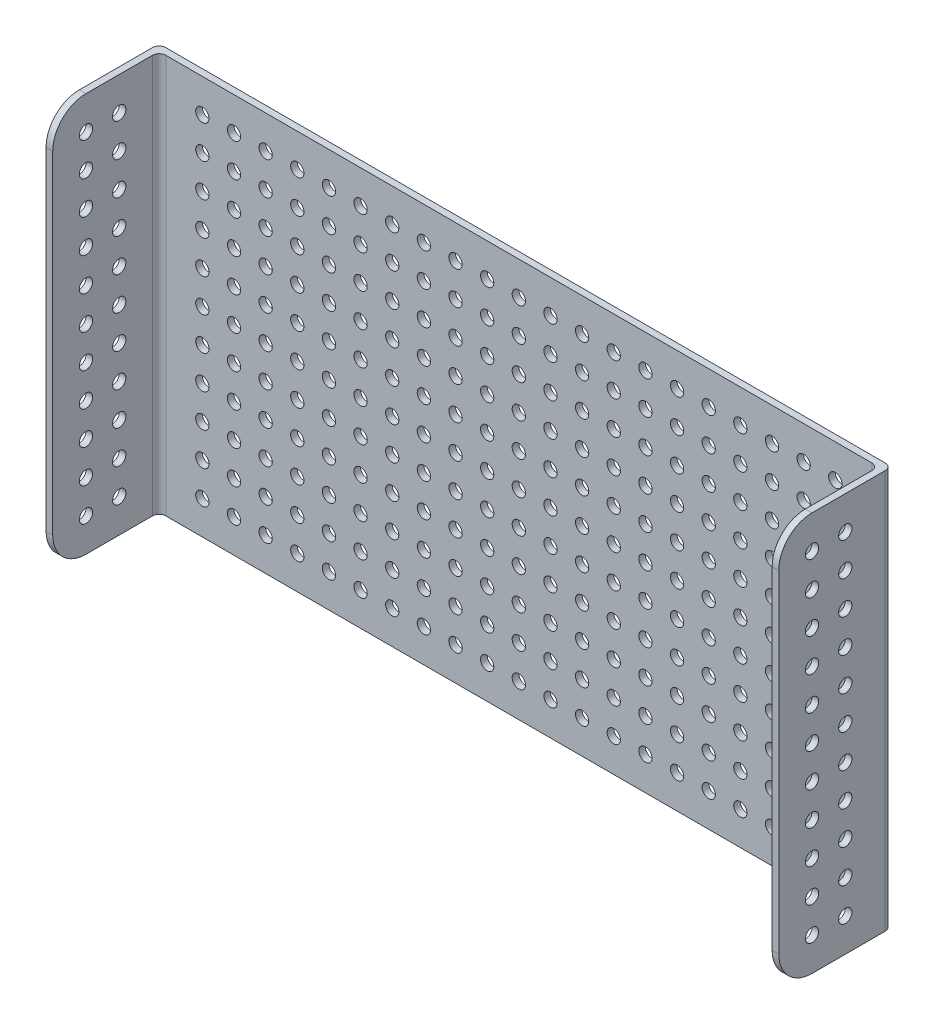
from build123d import *

# Parameters (mm, degrees)
IZIM1_W                     = 220.4
IZIM1_H                     = 120
IZIM1_R                     = 2
Y_KSEKLIK_EKSTR_ZYON1_DEPTH = 2
IZIM3_W                     = 2
IZIM3_H                     = 120
TOP_HOLES_DEPTH             = 32
IZIM4_R                     = 2
KES_EKSTR_ZYON1_DEPTH       = 231.937567321
RADYUS1_R                   = 2
RADYUS2_R                   = 10


with BuildPart() as part:
    # Çizim1 → Yükseklik-Ekstrüzyon1 (new body)
    with BuildSketch(Plane.XY):
        Rectangle(IZIM1_W, IZIM1_H)
        with Locations((95.2, 50)):
            Circle(IZIM1_R, mode=Mode.SUBTRACT)
        with Locations((85.68, 50)):
            Circle(IZIM1_R, mode=Mode.SUBTRACT)
        with Locations((76.16, 50)):
            Circle(IZIM1_R, mode=Mode.SUBTRACT)
        with Locations((66.64, 50)):
            Circle(IZIM1_R, mode=Mode.SUBTRACT)
        with Locations((57.12, 50)):
            Circle(IZIM1_R, mode=Mode.SUBTRACT)
        with Locations((47.6, 50)):
            Circle(IZIM1_R, mode=Mode.SUBTRACT)
        with Locations((38.08, 50)):
            Circle(IZIM1_R, mode=Mode.SUBTRACT)
        with Locations((28.56, 50)):
            Circle(IZIM1_R, mode=Mode.SUBTRACT)
        with Locations((19.04, 50)):
            Circle(IZIM1_R, mode=Mode.SUBTRACT)
        with Locations((9.52, 50)):
            Circle(IZIM1_R, mode=Mode.SUBTRACT)
        with Locations((0, 50)):
            Circle(IZIM1_R, mode=Mode.SUBTRACT)
        with Locations((-9.52, 50)):
            Circle(IZIM1_R, mode=Mode.SUBTRACT)
        with Locations((-19.04, 50)):
            Circle(IZIM1_R, mode=Mode.SUBTRACT)
        with Locations((-28.56, 50)):
            Circle(IZIM1_R, mode=Mode.SUBTRACT)
        with Locations((-38.08, 50)):
            Circle(IZIM1_R, mode=Mode.SUBTRACT)
        with Locations((-47.6, 50)):
            Circle(IZIM1_R, mode=Mode.SUBTRACT)
        with Locations((-57.12, 50)):
            Circle(IZIM1_R, mode=Mode.SUBTRACT)
        with Locations((-66.64, 50)):
            Circle(IZIM1_R, mode=Mode.SUBTRACT)
        with Locations((-76.16, 50)):
            Circle(IZIM1_R, mode=Mode.SUBTRACT)
        with Locations((-85.68, 50)):
            Circle(IZIM1_R, mode=Mode.SUBTRACT)
        with Locations((-95.2, 50)):
            Circle(IZIM1_R, mode=Mode.SUBTRACT)
        with Locations((85.68, 40)):
            Circle(IZIM1_R, mode=Mode.SUBTRACT)
        with Locations((76.16, 40)):
            Circle(IZIM1_R, mode=Mode.SUBTRACT)
        with Locations((66.64, 40)):
            Circle(IZIM1_R, mode=Mode.SUBTRACT)
        with Locations((57.12, 40)):
            Circle(IZIM1_R, mode=Mode.SUBTRACT)
        with Locations((47.6, 40)):
            Circle(IZIM1_R, mode=Mode.SUBTRACT)
        with Locations((38.08, 40)):
            Circle(IZIM1_R, mode=Mode.SUBTRACT)
        with Locations((28.56, 40)):
            Circle(IZIM1_R, mode=Mode.SUBTRACT)
        with Locations((19.04, 40)):
            Circle(IZIM1_R, mode=Mode.SUBTRACT)
        with Locations((9.52, 40)):
            Circle(IZIM1_R, mode=Mode.SUBTRACT)
        with Locations((0, 40)):
            Circle(IZIM1_R, mode=Mode.SUBTRACT)
        with Locations((-9.52, 40)):
            Circle(IZIM1_R, mode=Mode.SUBTRACT)
        with Locations((-19.04, 40)):
            Circle(IZIM1_R, mode=Mode.SUBTRACT)
        with Locations((-28.56, 40)):
            Circle(IZIM1_R, mode=Mode.SUBTRACT)
        with Locations((-38.08, 40)):
            Circle(IZIM1_R, mode=Mode.SUBTRACT)
        with Locations((-47.6, 40)):
            Circle(IZIM1_R, mode=Mode.SUBTRACT)
        with Locations((-57.12, 40)):
            Circle(IZIM1_R, mode=Mode.SUBTRACT)
        with Locations((-66.64, 40)):
            Circle(IZIM1_R, mode=Mode.SUBTRACT)
        with Locations((-76.16, 40)):
            Circle(IZIM1_R, mode=Mode.SUBTRACT)
        with Locations((-85.68, 40)):
            Circle(IZIM1_R, mode=Mode.SUBTRACT)
        with Locations((-95.2, 40)):
            Circle(IZIM1_R, mode=Mode.SUBTRACT)
        with Locations((85.68, 30)):
            Circle(IZIM1_R, mode=Mode.SUBTRACT)
        with Locations((76.16, 30)):
            Circle(IZIM1_R, mode=Mode.SUBTRACT)
        with Locations((66.64, 30)):
            Circle(IZIM1_R, mode=Mode.SUBTRACT)
        with Locations((57.12, 30)):
            Circle(IZIM1_R, mode=Mode.SUBTRACT)
        with Locations((47.6, 30)):
            Circle(IZIM1_R, mode=Mode.SUBTRACT)
        with Locations((38.08, 30)):
            Circle(IZIM1_R, mode=Mode.SUBTRACT)
        with Locations((28.56, 30)):
            Circle(IZIM1_R, mode=Mode.SUBTRACT)
        with Locations((19.04, 30)):
            Circle(IZIM1_R, mode=Mode.SUBTRACT)
        with Locations((9.52, 30)):
            Circle(IZIM1_R, mode=Mode.SUBTRACT)
        with Locations((0, 30)):
            Circle(IZIM1_R, mode=Mode.SUBTRACT)
        with Locations((-9.52, 30)):
            Circle(IZIM1_R, mode=Mode.SUBTRACT)
        with Locations((-19.04, 30)):
            Circle(IZIM1_R, mode=Mode.SUBTRACT)
        with Locations((-28.56, 30)):
            Circle(IZIM1_R, mode=Mode.SUBTRACT)
        with Locations((-38.08, 30)):
            Circle(IZIM1_R, mode=Mode.SUBTRACT)
        with Locations((-47.6, 30)):
            Circle(IZIM1_R, mode=Mode.SUBTRACT)
        with Locations((-57.12, 30)):
            Circle(IZIM1_R, mode=Mode.SUBTRACT)
        with Locations((-66.64, 30)):
            Circle(IZIM1_R, mode=Mode.SUBTRACT)
        with Locations((-76.16, 30)):
            Circle(IZIM1_R, mode=Mode.SUBTRACT)
        with Locations((-85.68, 30)):
            Circle(IZIM1_R, mode=Mode.SUBTRACT)
        with Locations((-95.2, 30)):
            Circle(IZIM1_R, mode=Mode.SUBTRACT)
        with Locations((85.68, 20)):
            Circle(IZIM1_R, mode=Mode.SUBTRACT)
        with Locations((76.16, 20)):
            Circle(IZIM1_R, mode=Mode.SUBTRACT)
        with Locations((66.64, 20)):
            Circle(IZIM1_R, mode=Mode.SUBTRACT)
        with Locations((57.12, 20)):
            Circle(IZIM1_R, mode=Mode.SUBTRACT)
        with Locations((47.6, 20)):
            Circle(IZIM1_R, mode=Mode.SUBTRACT)
        with Locations((38.08, 20)):
            Circle(IZIM1_R, mode=Mode.SUBTRACT)
        with Locations((28.56, 20)):
            Circle(IZIM1_R, mode=Mode.SUBTRACT)
        with Locations((19.04, 20)):
            Circle(IZIM1_R, mode=Mode.SUBTRACT)
        with Locations((9.52, 20)):
            Circle(IZIM1_R, mode=Mode.SUBTRACT)
        with Locations((0, 20)):
            Circle(IZIM1_R, mode=Mode.SUBTRACT)
        with Locations((-9.52, 20)):
            Circle(IZIM1_R, mode=Mode.SUBTRACT)
        with Locations((-19.04, 20)):
            Circle(IZIM1_R, mode=Mode.SUBTRACT)
        with Locations((-28.56, 20)):
            Circle(IZIM1_R, mode=Mode.SUBTRACT)
        with Locations((-38.08, 20)):
            Circle(IZIM1_R, mode=Mode.SUBTRACT)
        with Locations((-47.6, 20)):
            Circle(IZIM1_R, mode=Mode.SUBTRACT)
        with Locations((-57.12, 20)):
            Circle(IZIM1_R, mode=Mode.SUBTRACT)
        with Locations((-66.64, 20)):
            Circle(IZIM1_R, mode=Mode.SUBTRACT)
        with Locations((-76.16, 20)):
            Circle(IZIM1_R, mode=Mode.SUBTRACT)
        with Locations((-85.68, 20)):
            Circle(IZIM1_R, mode=Mode.SUBTRACT)
        with Locations((-95.2, 20)):
            Circle(IZIM1_R, mode=Mode.SUBTRACT)
        with Locations((85.68, 10)):
            Circle(IZIM1_R, mode=Mode.SUBTRACT)
        with Locations((76.16, 10)):
            Circle(IZIM1_R, mode=Mode.SUBTRACT)
        with Locations((66.64, 10)):
            Circle(IZIM1_R, mode=Mode.SUBTRACT)
        with Locations((57.12, 10)):
            Circle(IZIM1_R, mode=Mode.SUBTRACT)
        with Locations((47.6, 10)):
            Circle(IZIM1_R, mode=Mode.SUBTRACT)
        with Locations((38.08, 10)):
            Circle(IZIM1_R, mode=Mode.SUBTRACT)
        with Locations((28.56, 10)):
            Circle(IZIM1_R, mode=Mode.SUBTRACT)
        with Locations((19.04, 10)):
            Circle(IZIM1_R, mode=Mode.SUBTRACT)
        with Locations((9.52, 10)):
            Circle(IZIM1_R, mode=Mode.SUBTRACT)
        with Locations((0, 10)):
            Circle(IZIM1_R, mode=Mode.SUBTRACT)
        with Locations((-9.52, 10)):
            Circle(IZIM1_R, mode=Mode.SUBTRACT)
        with Locations((-19.04, 10)):
            Circle(IZIM1_R, mode=Mode.SUBTRACT)
        with Locations((-28.56, 10)):
            Circle(IZIM1_R, mode=Mode.SUBTRACT)
        with Locations((-38.08, 10)):
            Circle(IZIM1_R, mode=Mode.SUBTRACT)
        with Locations((-47.6, 10)):
            Circle(IZIM1_R, mode=Mode.SUBTRACT)
        with Locations((-57.12, 10)):
            Circle(IZIM1_R, mode=Mode.SUBTRACT)
        with Locations((-66.64, 10)):
            Circle(IZIM1_R, mode=Mode.SUBTRACT)
        with Locations((-76.16, 10)):
            Circle(IZIM1_R, mode=Mode.SUBTRACT)
        with Locations((-85.68, 10)):
            Circle(IZIM1_R, mode=Mode.SUBTRACT)
        with Locations((-95.2, 10)):
            Circle(IZIM1_R, mode=Mode.SUBTRACT)
        with Locations((85.68, 0)):
            Circle(IZIM1_R, mode=Mode.SUBTRACT)
        with Locations((76.16, 0)):
            Circle(IZIM1_R, mode=Mode.SUBTRACT)
        with Locations((66.64, 0)):
            Circle(IZIM1_R, mode=Mode.SUBTRACT)
        with Locations((57.12, 0)):
            Circle(IZIM1_R, mode=Mode.SUBTRACT)
        with Locations((47.6, 0)):
            Circle(IZIM1_R, mode=Mode.SUBTRACT)
        with Locations((38.08, 0)):
            Circle(IZIM1_R, mode=Mode.SUBTRACT)
        with Locations((28.56, 0)):
            Circle(IZIM1_R, mode=Mode.SUBTRACT)
        with Locations((19.04, 0)):
            Circle(IZIM1_R, mode=Mode.SUBTRACT)
        with Locations((9.52, 0)):
            Circle(IZIM1_R, mode=Mode.SUBTRACT)
        Circle(IZIM1_R, mode=Mode.SUBTRACT)
        with Locations((-9.52, 0)):
            Circle(IZIM1_R, mode=Mode.SUBTRACT)
        with Locations((-19.04, 0)):
            Circle(IZIM1_R, mode=Mode.SUBTRACT)
        with Locations((-28.56, 0)):
            Circle(IZIM1_R, mode=Mode.SUBTRACT)
        with Locations((-38.08, 0)):
            Circle(IZIM1_R, mode=Mode.SUBTRACT)
        with Locations((-47.6, 0)):
            Circle(IZIM1_R, mode=Mode.SUBTRACT)
        with Locations((-57.12, 0)):
            Circle(IZIM1_R, mode=Mode.SUBTRACT)
        with Locations((-66.64, 0)):
            Circle(IZIM1_R, mode=Mode.SUBTRACT)
        with Locations((-76.16, 0)):
            Circle(IZIM1_R, mode=Mode.SUBTRACT)
        with Locations((-85.68, 0)):
            Circle(IZIM1_R, mode=Mode.SUBTRACT)
        with Locations((-95.2, 0)):
            Circle(IZIM1_R, mode=Mode.SUBTRACT)
        with Locations((85.68, -10)):
            Circle(IZIM1_R, mode=Mode.SUBTRACT)
        with Locations((76.16, -10)):
            Circle(IZIM1_R, mode=Mode.SUBTRACT)
        with Locations((66.64, -10)):
            Circle(IZIM1_R, mode=Mode.SUBTRACT)
        with Locations((57.12, -10)):
            Circle(IZIM1_R, mode=Mode.SUBTRACT)
        with Locations((47.6, -10)):
            Circle(IZIM1_R, mode=Mode.SUBTRACT)
        with Locations((38.08, -10)):
            Circle(IZIM1_R, mode=Mode.SUBTRACT)
        with Locations((28.56, -10)):
            Circle(IZIM1_R, mode=Mode.SUBTRACT)
        with Locations((19.04, -10)):
            Circle(IZIM1_R, mode=Mode.SUBTRACT)
        with Locations((9.52, -10)):
            Circle(IZIM1_R, mode=Mode.SUBTRACT)
        with Locations((0, -10)):
            Circle(IZIM1_R, mode=Mode.SUBTRACT)
        with Locations((-9.52, -10)):
            Circle(IZIM1_R, mode=Mode.SUBTRACT)
        with Locations((-19.04, -10)):
            Circle(IZIM1_R, mode=Mode.SUBTRACT)
        with Locations((-28.56, -10)):
            Circle(IZIM1_R, mode=Mode.SUBTRACT)
        with Locations((-38.08, -10)):
            Circle(IZIM1_R, mode=Mode.SUBTRACT)
        with Locations((-47.6, -10)):
            Circle(IZIM1_R, mode=Mode.SUBTRACT)
        with Locations((-57.12, -10)):
            Circle(IZIM1_R, mode=Mode.SUBTRACT)
        with Locations((-66.64, -10)):
            Circle(IZIM1_R, mode=Mode.SUBTRACT)
        with Locations((-76.16, -10)):
            Circle(IZIM1_R, mode=Mode.SUBTRACT)
        with Locations((-85.68, -10)):
            Circle(IZIM1_R, mode=Mode.SUBTRACT)
        with Locations((-95.2, -10)):
            Circle(IZIM1_R, mode=Mode.SUBTRACT)
        with Locations((85.68, -20)):
            Circle(IZIM1_R, mode=Mode.SUBTRACT)
        with Locations((76.16, -20)):
            Circle(IZIM1_R, mode=Mode.SUBTRACT)
        with Locations((66.64, -20)):
            Circle(IZIM1_R, mode=Mode.SUBTRACT)
        with Locations((57.12, -20)):
            Circle(IZIM1_R, mode=Mode.SUBTRACT)
        with Locations((47.6, -20)):
            Circle(IZIM1_R, mode=Mode.SUBTRACT)
        with Locations((38.08, -20)):
            Circle(IZIM1_R, mode=Mode.SUBTRACT)
        with Locations((28.56, -20)):
            Circle(IZIM1_R, mode=Mode.SUBTRACT)
        with Locations((19.04, -20)):
            Circle(IZIM1_R, mode=Mode.SUBTRACT)
        with Locations((9.52, -20)):
            Circle(IZIM1_R, mode=Mode.SUBTRACT)
        with Locations((0, -20)):
            Circle(IZIM1_R, mode=Mode.SUBTRACT)
        with Locations((-9.52, -20)):
            Circle(IZIM1_R, mode=Mode.SUBTRACT)
        with Locations((-19.04, -20)):
            Circle(IZIM1_R, mode=Mode.SUBTRACT)
        with Locations((-28.56, -20)):
            Circle(IZIM1_R, mode=Mode.SUBTRACT)
        with Locations((-38.08, -20)):
            Circle(IZIM1_R, mode=Mode.SUBTRACT)
        with Locations((-47.6, -20)):
            Circle(IZIM1_R, mode=Mode.SUBTRACT)
        with Locations((-57.12, -20)):
            Circle(IZIM1_R, mode=Mode.SUBTRACT)
        with Locations((-66.64, -20)):
            Circle(IZIM1_R, mode=Mode.SUBTRACT)
        with Locations((-76.16, -20)):
            Circle(IZIM1_R, mode=Mode.SUBTRACT)
        with Locations((-85.68, -20)):
            Circle(IZIM1_R, mode=Mode.SUBTRACT)
        with Locations((-95.2, -20)):
            Circle(IZIM1_R, mode=Mode.SUBTRACT)
        with Locations((85.68, -30)):
            Circle(IZIM1_R, mode=Mode.SUBTRACT)
        with Locations((76.16, -30)):
            Circle(IZIM1_R, mode=Mode.SUBTRACT)
        with Locations((66.64, -30)):
            Circle(IZIM1_R, mode=Mode.SUBTRACT)
        with Locations((57.12, -30)):
            Circle(IZIM1_R, mode=Mode.SUBTRACT)
        with Locations((47.6, -30)):
            Circle(IZIM1_R, mode=Mode.SUBTRACT)
        with Locations((38.08, -30)):
            Circle(IZIM1_R, mode=Mode.SUBTRACT)
        with Locations((28.56, -30)):
            Circle(IZIM1_R, mode=Mode.SUBTRACT)
        with Locations((19.04, -30)):
            Circle(IZIM1_R, mode=Mode.SUBTRACT)
        with Locations((9.52, -30)):
            Circle(IZIM1_R, mode=Mode.SUBTRACT)
        with Locations((0, -30)):
            Circle(IZIM1_R, mode=Mode.SUBTRACT)
        with Locations((-9.52, -30)):
            Circle(IZIM1_R, mode=Mode.SUBTRACT)
        with Locations((-19.04, -30)):
            Circle(IZIM1_R, mode=Mode.SUBTRACT)
        with Locations((-28.56, -30)):
            Circle(IZIM1_R, mode=Mode.SUBTRACT)
        with Locations((-38.08, -30)):
            Circle(IZIM1_R, mode=Mode.SUBTRACT)
        with Locations((-47.6, -30)):
            Circle(IZIM1_R, mode=Mode.SUBTRACT)
        with Locations((-57.12, -30)):
            Circle(IZIM1_R, mode=Mode.SUBTRACT)
        with Locations((-66.64, -30)):
            Circle(IZIM1_R, mode=Mode.SUBTRACT)
        with Locations((-76.16, -30)):
            Circle(IZIM1_R, mode=Mode.SUBTRACT)
        with Locations((-85.68, -30)):
            Circle(IZIM1_R, mode=Mode.SUBTRACT)
        with Locations((-95.2, -30)):
            Circle(IZIM1_R, mode=Mode.SUBTRACT)
        with Locations((85.68, -40)):
            Circle(IZIM1_R, mode=Mode.SUBTRACT)
        with Locations((76.16, -40)):
            Circle(IZIM1_R, mode=Mode.SUBTRACT)
        with Locations((66.64, -40)):
            Circle(IZIM1_R, mode=Mode.SUBTRACT)
        with Locations((57.12, -40)):
            Circle(IZIM1_R, mode=Mode.SUBTRACT)
        with Locations((47.6, -40)):
            Circle(IZIM1_R, mode=Mode.SUBTRACT)
        with Locations((38.08, -40)):
            Circle(IZIM1_R, mode=Mode.SUBTRACT)
        with Locations((28.56, -40)):
            Circle(IZIM1_R, mode=Mode.SUBTRACT)
        with Locations((19.04, -40)):
            Circle(IZIM1_R, mode=Mode.SUBTRACT)
        with Locations((9.52, -40)):
            Circle(IZIM1_R, mode=Mode.SUBTRACT)
        with Locations((0, -40)):
            Circle(IZIM1_R, mode=Mode.SUBTRACT)
        with Locations((-9.52, -40)):
            Circle(IZIM1_R, mode=Mode.SUBTRACT)
        with Locations((-19.04, -40)):
            Circle(IZIM1_R, mode=Mode.SUBTRACT)
        with Locations((-28.56, -40)):
            Circle(IZIM1_R, mode=Mode.SUBTRACT)
        with Locations((-38.08, -40)):
            Circle(IZIM1_R, mode=Mode.SUBTRACT)
        with Locations((-47.6, -40)):
            Circle(IZIM1_R, mode=Mode.SUBTRACT)
        with Locations((-57.12, -40)):
            Circle(IZIM1_R, mode=Mode.SUBTRACT)
        with Locations((-66.64, -40)):
            Circle(IZIM1_R, mode=Mode.SUBTRACT)
        with Locations((-76.16, -40)):
            Circle(IZIM1_R, mode=Mode.SUBTRACT)
        with Locations((-85.68, -40)):
            Circle(IZIM1_R, mode=Mode.SUBTRACT)
        with Locations((-95.2, -40)):
            Circle(IZIM1_R, mode=Mode.SUBTRACT)
        with Locations((85.68, -50)):
            Circle(IZIM1_R, mode=Mode.SUBTRACT)
        with Locations((76.16, -50)):
            Circle(IZIM1_R, mode=Mode.SUBTRACT)
        with Locations((66.64, -50)):
            Circle(IZIM1_R, mode=Mode.SUBTRACT)
        with Locations((57.12, -50)):
            Circle(IZIM1_R, mode=Mode.SUBTRACT)
        with Locations((47.6, -50)):
            Circle(IZIM1_R, mode=Mode.SUBTRACT)
        with Locations((38.08, -50)):
            Circle(IZIM1_R, mode=Mode.SUBTRACT)
        with Locations((28.56, -50)):
            Circle(IZIM1_R, mode=Mode.SUBTRACT)
        with Locations((19.04, -50)):
            Circle(IZIM1_R, mode=Mode.SUBTRACT)
        with Locations((9.52, -50)):
            Circle(IZIM1_R, mode=Mode.SUBTRACT)
        with Locations((0, -50)):
            Circle(IZIM1_R, mode=Mode.SUBTRACT)
        with Locations((-9.52, -50)):
            Circle(IZIM1_R, mode=Mode.SUBTRACT)
        with Locations((-19.04, -50)):
            Circle(IZIM1_R, mode=Mode.SUBTRACT)
        with Locations((-28.56, -50)):
            Circle(IZIM1_R, mode=Mode.SUBTRACT)
        with Locations((-38.08, -50)):
            Circle(IZIM1_R, mode=Mode.SUBTRACT)
        with Locations((-47.6, -50)):
            Circle(IZIM1_R, mode=Mode.SUBTRACT)
        with Locations((-57.12, -50)):
            Circle(IZIM1_R, mode=Mode.SUBTRACT)
        with Locations((-66.64, -50)):
            Circle(IZIM1_R, mode=Mode.SUBTRACT)
        with Locations((-76.16, -50)):
            Circle(IZIM1_R, mode=Mode.SUBTRACT)
        with Locations((-85.68, -50)):
            Circle(IZIM1_R, mode=Mode.SUBTRACT)
        with Locations((-95.2, -50)):
            Circle(IZIM1_R, mode=Mode.SUBTRACT)
        with Locations((95.2, 40)):
            Circle(IZIM1_R, mode=Mode.SUBTRACT)
        with Locations((95.2, 30)):
            Circle(IZIM1_R, mode=Mode.SUBTRACT)
        with Locations((95.2, 20)):
            Circle(IZIM1_R, mode=Mode.SUBTRACT)
        with Locations((95.2, 10)):
            Circle(IZIM1_R, mode=Mode.SUBTRACT)
        with Locations((95.2, 0)):
            Circle(IZIM1_R, mode=Mode.SUBTRACT)
        with Locations((95.2, -10)):
            Circle(IZIM1_R, mode=Mode.SUBTRACT)
        with Locations((95.2, -20)):
            Circle(IZIM1_R, mode=Mode.SUBTRACT)
        with Locations((95.2, -30)):
            Circle(IZIM1_R, mode=Mode.SUBTRACT)
        with Locations((95.2, -40)):
            Circle(IZIM1_R, mode=Mode.SUBTRACT)
        with Locations((95.2, -50)):
            Circle(IZIM1_R, mode=Mode.SUBTRACT)
    extrude(amount=Y_KSEKLIK_EKSTR_ZYON1_DEPTH)

    # Çizim3 → Top Holes (add)
    with BuildSketch(Plane.XY.offset(2)):
        with Locations((-109.2, 0)):
            Rectangle(IZIM3_W, IZIM3_H)
        with Locations((109.2, 0)):
            Rectangle(IZIM3_W, IZIM3_H)
    extrude(amount=TOP_HOLES_DEPTH)

    # Çizim4 → Kes-Ekstrüzyon1 (cut, through all)
    with BuildSketch(Plane.ZY.offset(110.2)):
        with Locations(Location((14, -50, 0), (0, 0, 270))):
            Circle(IZIM4_R)
        with Locations(Location((24, -50, 0), (0, 0, 270))):
            Circle(IZIM4_R)
        with Locations(Location((24, -40, 0), (0, 0, 270))):
            Circle(IZIM4_R)
        with Locations(Location((24, -30, 0), (0, 0, 270))):
            Circle(IZIM4_R)
        with Locations(Location((24, -20, 0), (0, 0, 270))):
            Circle(IZIM4_R)
        with Locations(Location((24, -10, 0), (0, 0, 270))):
            Circle(IZIM4_R)
        with Locations(Location((24, 0, 0), (0, 0, 270))):
            Circle(IZIM4_R)
        with Locations(Location((24, 10, 0), (0, 0, 270))):
            Circle(IZIM4_R)
        with Locations(Location((24, 20, 0), (0, 0, 270))):
            Circle(IZIM4_R)
        with Locations(Location((24, 30, 0), (0, 0, 270))):
            Circle(IZIM4_R)
        with Locations(Location((24, 40, 0), (0, 0, 270))):
            Circle(IZIM4_R)
        with Locations(Location((24, 50, 0), (0, 0, 270))):
            Circle(IZIM4_R)
        with Locations(Location((14, -40, 0), (0, 0, 270))):
            Circle(IZIM4_R)
        with Locations(Location((14, -30, 0), (0, 0, 270))):
            Circle(IZIM4_R)
        with Locations(Location((14, -20, 0), (0, 0, 270))):
            Circle(IZIM4_R)
        with Locations(Location((14, -10, 0), (0, 0, 270))):
            Circle(IZIM4_R)
        with Locations(Location((14, 0, 0), (0, 0, 270))):
            Circle(IZIM4_R)
        with Locations(Location((14, 10, 0), (0, 0, 270))):
            Circle(IZIM4_R)
        with Locations(Location((14, 20, 0), (0, 0, 270))):
            Circle(IZIM4_R)
        with Locations(Location((14, 30, 0), (0, 0, 270))):
            Circle(IZIM4_R)
        with Locations(Location((14, 40, 0), (0, 0, 270))):
            Circle(IZIM4_R)
        with Locations(Location((14, 50, 0), (0, 0, 270))):
            Circle(IZIM4_R)
    extrude(amount=-KES_EKSTR_ZYON1_DEPTH, mode=Mode.SUBTRACT)

    # Radyus1
    radyus1_edges = [part.edges().sort_by_distance(p)[0] for p in [
        (110.2, 0, 0),
        (-110.2, 0, 0),
        (-108.2, 0, 2),
        (108.2, 0, 2),
    ]]
    fillet(radyus1_edges, radius=RADYUS1_R)

    # Radyus2
    radyus2_edges = [part.edges().sort_by_distance(p)[0] for p in [
        (-109.2, -60, 34),
        (-109.2, 60, 34),
        (109.2, -60, 34),
        (109.2, 60, 34),
    ]]
    fillet(radyus2_edges, radius=RADYUS2_R)


solid = part.part
